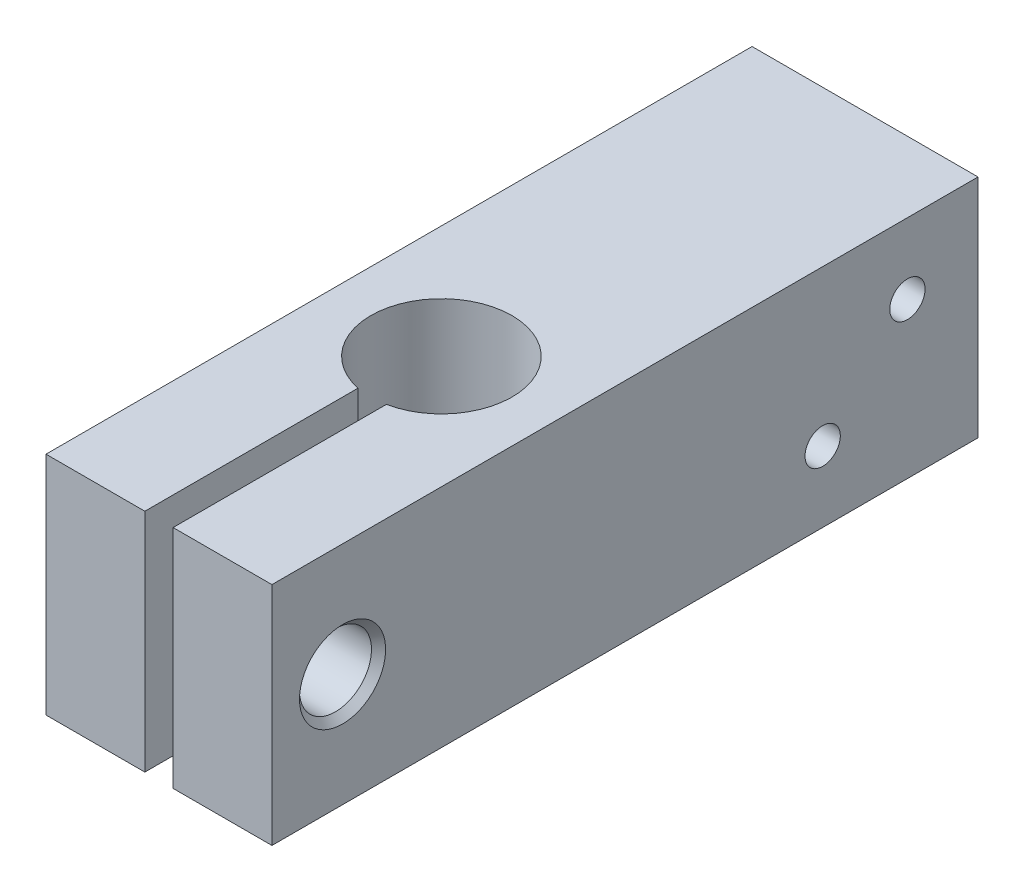
from build123d import *

# Parameters (mm, degrees)
SKETCH1_W                                  = 16
SKETCH1_H                                  = 16
BASE_DEPTH                                 = 50
SKETCH2_R                                  = 5
RODSLOT_DEPTH                              = 54.103672189
RODSCREWMOUNT_REACH                        = 55.104
SKETCH3_R                                  = 2.55
CHAMFERFORRODSCREW_SIZE                    = 0.5
M5X0_8_TAPPED_HOLE_FOR_ROD_SCREW_D         = 4.2
M5X0_8_TAPPED_HOLE_FOR_ROD_SCREW_DEPTH     = 7.6381927
M5X0_8_TAPPED_HOLE_FOR_ROD_SCREW_TIP       = 1.2618073
M3X0_5_TAPPED_HOLE_FOR_MOUNT_WITH_SECOND_D = 2.5


with BuildPart() as part:
    # Sketch1 → Base (new body)
    with BuildSketch(Plane.XY):
        Rectangle(SKETCH1_W, SKETCH1_H)
    extrude(amount=BASE_DEPTH)

    # Sketch2 → RodSlot (cut, through all)
    with BuildSketch(Plane(origin=(0, 8, 0), x_dir=(1, 0, 0), z_dir=(0, 1, 0))):
        with Locations((0, -30)):
            Circle(SKETCH2_R)
        with BuildLine():
            Line((-1, -34.898979486), (-1, -50))
            Line((-1, -50), (1, -50))
            Line((1, -50), (1, -34.898979486))
            ThreePointArc((1, -34.898979486), (0, -35), (-1, -34.898979486))
        make_face()
    extrude(amount=-RODSLOT_DEPTH, mode=Mode.SUBTRACT)

    # Sketch3 → RodScrewMount (cut, up to next)
    with BuildSketch(Plane(origin=(8, 0, 0), x_dir=(0, 0, -1), z_dir=(1, 0, 0)), mode=Mode.PRIVATE) as rodscrewmount_sk1:
        with Locations((-45, 0)):
            Circle(SKETCH3_R)
    rodscrewmount_tool1 = extrude(rodscrewmount_sk1.sketch, amount=-RODSCREWMOUNT_REACH, mode=Mode.PRIVATE) & part.part
    add(rodscrewmount_tool1.solids().sort_by_distance((8, 0, 45))[0], mode=Mode.SUBTRACT)

    # ChamferForRodScrew
    chamferforrodscrew_edges = [part.edges().sort_by_distance(p)[0] for p in [
        (8, 0, 47.55),
    ]]
    chamfer(chamferforrodscrew_edges, length=CHAMFERFORRODSCREW_SIZE)

    # M5x0.8 Tapped Hole for rod screw
    with Locations(Plane.ZY.offset(8)):
        with Locations((45, 0)):
            Hole(M5X0_8_TAPPED_HOLE_FOR_ROD_SCREW_D / 2, depth=M5X0_8_TAPPED_HOLE_FOR_ROD_SCREW_DEPTH)
            with Locations((0, 0, -(M5X0_8_TAPPED_HOLE_FOR_ROD_SCREW_DEPTH + M5X0_8_TAPPED_HOLE_FOR_ROD_SCREW_TIP / 2))):  # 118° drill point
                Cone(0, M5X0_8_TAPPED_HOLE_FOR_ROD_SCREW_D / 2, M5X0_8_TAPPED_HOLE_FOR_ROD_SCREW_TIP, mode=Mode.SUBTRACT)

    # M3x0.5 Tapped Hole for mount with second part (through all)
    with Locations(Plane.ZY.offset(8)):
        with Locations((5, 3), (11, -3)):
            Hole(M3X0_5_TAPPED_HOLE_FOR_MOUNT_WITH_SECOND_D / 2)


solid = part.part
